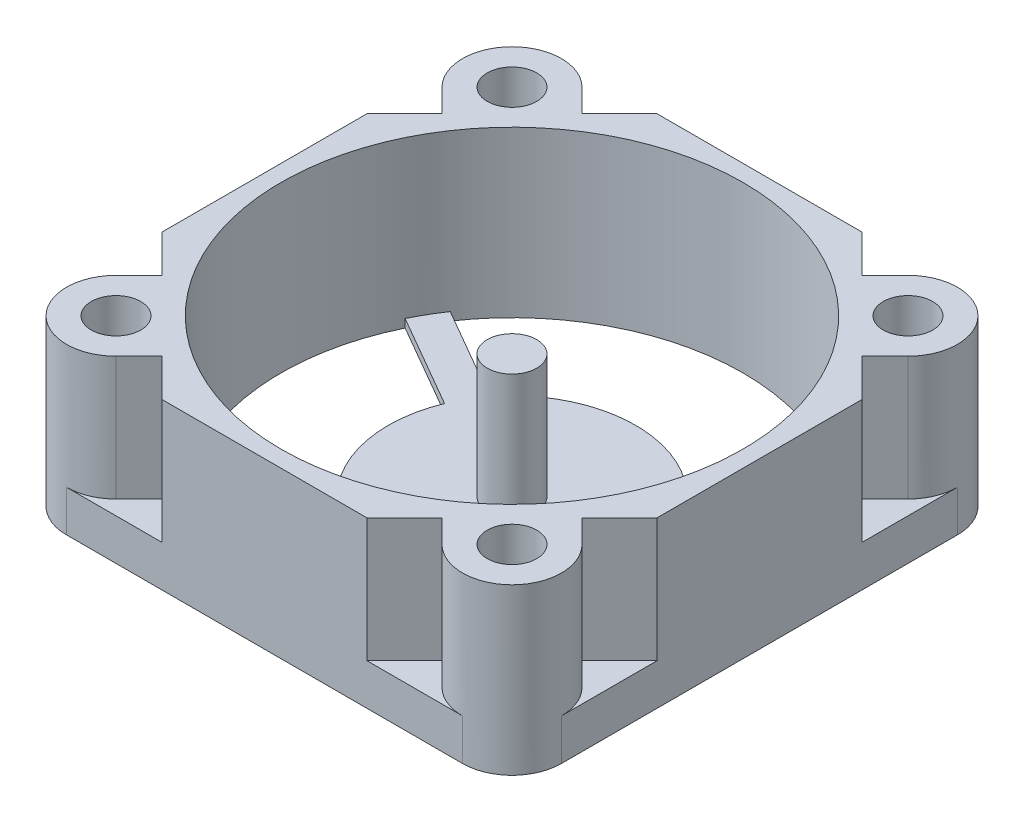
from build123d import *

# Parameters (mm, degrees)
SKETCH1_R           = 1.5
BOSS_EXTRUDE1_DEPTH = 10
SKETCH2_R           = 14
CUT_EXTRUDE1_DEPTH  = 9.5
CUT_EXTRUDE2_START  = -10
CUT_EXTRUDE2_DEPTH  = 10
SKETCH4_R           = 1.5
BOSS_EXTRUDE2_DEPTH = 7.5
CUT_EXTRUDE3_START  = -7.5
CUT_EXTRUDE3_DEPTH  = 7.5


with BuildPart() as part:
    # Sketch1 → Boss-Extrude1 (new body)
    with BuildSketch(Plane(origin=(0, 0, 0), x_dir=(1, 0, 0), z_dir=(0, 1, 0))):
        with BuildLine():
            Line((-12, 15), (12, 15))
            ThreePointArc((12, 15), (14.121320344, 14.121320344), (15, 12))
            Line((15, 12), (15, -12))
            ThreePointArc((15, -12), (14.121320344, -14.121320344), (12, -15))
            Line((12, -15), (-12, -15))
            ThreePointArc((-12, -15), (-14.121320344, -14.121320344), (-15, -12))
            Line((-15, -12), (-15, 12))
            ThreePointArc((-15, 12), (-14.121320344, 14.121320344), (-12, 15))
        make_face()
        with Locations(Location((-12, -12, 0), (0, 0, 270))):
            Circle(SKETCH1_R, mode=Mode.SUBTRACT)
        with Locations(Location((-12, 12, 0), (0, 0, 270))):
            Circle(SKETCH1_R, mode=Mode.SUBTRACT)
        with Locations(Location((12, 12, 0), (0, 0, 270))):
            Circle(SKETCH1_R, mode=Mode.SUBTRACT)
        with Locations(Location((12, -12, 0), (0, 0, 270))):
            Circle(SKETCH1_R, mode=Mode.SUBTRACT)
    extrude(amount=BOSS_EXTRUDE1_DEPTH)

    # Sketch2 → Cut-Extrude1 (cut)
    with BuildSketch(Plane(origin=(0, 10, 0), x_dir=(1, 0, 0), z_dir=(0, 1, 0))):
        with Locations(Location((0, 0, 0), (0, 0, 270))):
            Circle(SKETCH2_R)
    extrude(amount=-CUT_EXTRUDE1_DEPTH, mode=Mode.SUBTRACT)

    # Sketch3 → Cut-Extrude2 (cut)
    with BuildSketch(Plane.XZ.offset(CUT_EXTRUDE2_START)):
        with BuildLine():
            Line((6.937196595, -2.850491783), (12.593386622, -6.116094618))
            ThreePointArc((12.593386622, -6.116094618), (12.124355653, 7), (1, 13.964240044))
            Line((1, 13.964240044), (1, 7.433034374))
            ThreePointArc((1, 7.433034374), (6.495190528, 3.75), (6.937196595, -2.850491783))
        make_face()
        with BuildLine():
            Line((5.937196595, -4.582542591), (11.593386622, -7.848145426))
            ThreePointArc((11.593386622, -7.848145426), (0, -14), (-11.593386622, -7.848145426))
            Line((-11.593386622, -7.848145426), (-5.937196595, -4.582542591))
            ThreePointArc((-5.937196595, -4.582542591), (0, -7.5), (5.937196595, -4.582542591))
        make_face()
        with BuildLine():
            Line((-1, 7.433034374), (-1, 13.964240044))
            ThreePointArc((-1, 13.964240044), (-12.124355653, 7), (-12.593386622, -6.116094618))
            Line((-12.593386622, -6.116094618), (-6.937196595, -2.850491783))
            ThreePointArc((-6.937196595, -2.850491783), (-6.495190528, 3.75), (-1, 7.433034374))
        make_face()
    extrude(amount=CUT_EXTRUDE2_DEPTH, mode=Mode.SUBTRACT)

    # Sketch4 → Boss-Extrude2 (add)
    with BuildSketch(Plane(origin=(0, 0.5, 0), x_dir=(1, 0, 0), z_dir=(0, 1, 0))):
        with Locations(Location((0, 0, 0), (0, 0, 270))):
            Circle(SKETCH4_R)
    extrude(amount=BOSS_EXTRUDE2_DEPTH)

    # Sketch5 → Cut-Extrude3 (cut)
    with BuildSketch(Plane(origin=(0, 10, 0), x_dir=(1, 0, 0), z_dir=(0, 1, 0)).offset(CUT_EXTRUDE3_START)):
        with BuildLine():
            Line((-6.213203436, 15), (-8.485281374, 12.727922061))
            Line((-8.485281374, 12.727922061), (-9.878679656, 14.121320344))
            ThreePointArc((-9.878679656, 14.121320344), (-10.851949703, 14.771638598), (-12, 15))
            Line((-12, 15), (-6.213203436, 15))
        make_face()
        with BuildLine():
            Line((-14.121320344, 9.878679656), (-12.727922061, 8.485281374))
            Line((-12.727922061, 8.485281374), (-15, 6.213203436))
            Line((-15, 6.213203436), (-15, 12))
            ThreePointArc((-15, 12), (-14.771638598, 10.851949703), (-14.121320344, 9.878679656))
        make_face()
        with BuildLine():
            Line((15, 6.213203436), (12.727922061, 8.485281374))
            Line((12.727922061, 8.485281374), (14.121320344, 9.878679656))
            ThreePointArc((14.121320344, 9.878679656), (14.771638598, 10.851949703), (15, 12))
            Line((15, 12), (15, 6.213203436))
        make_face()
        with BuildLine():
            Line((9.878679656, 14.121320344), (8.485281374, 12.727922061))
            Line((8.485281374, 12.727922061), (6.213203436, 15))
            Line((6.213203436, 15), (12, 15))
            ThreePointArc((12, 15), (10.851949703, 14.771638598), (9.878679656, 14.121320344))
        make_face()
        with BuildLine():
            Line((6.213203436, -15), (8.485281374, -12.727922061))
            Line((8.485281374, -12.727922061), (9.878679656, -14.121320344))
            ThreePointArc((9.878679656, -14.121320344), (10.851949703, -14.771638598), (12, -15))
            Line((12, -15), (6.213203436, -15))
        make_face()
        with BuildLine():
            Line((14.121320344, -9.878679656), (12.727922061, -8.485281374))
            Line((12.727922061, -8.485281374), (15, -6.213203436))
            Line((15, -6.213203436), (15, -12))
            ThreePointArc((15, -12), (14.771638598, -10.851949703), (14.121320344, -9.878679656))
        make_face()
        with BuildLine():
            Line((-15, -6.213203436), (-12.727922061, -8.485281374))
            Line((-12.727922061, -8.485281374), (-14.121320344, -9.878679656))
            ThreePointArc((-14.121320344, -9.878679656), (-14.771638598, -10.851949703), (-15, -12))
            Line((-15, -12), (-15, -6.213203436))
        make_face()
        with BuildLine():
            Line((-9.878679656, -14.121320344), (-8.485281374, -12.727922061))
            Line((-8.485281374, -12.727922061), (-6.213203436, -15))
            Line((-6.213203436, -15), (-12, -15))
            ThreePointArc((-12, -15), (-10.851949703, -14.771638598), (-9.878679656, -14.121320344))
        make_face()
    extrude(amount=CUT_EXTRUDE3_DEPTH, mode=Mode.SUBTRACT)


solid = part.part
